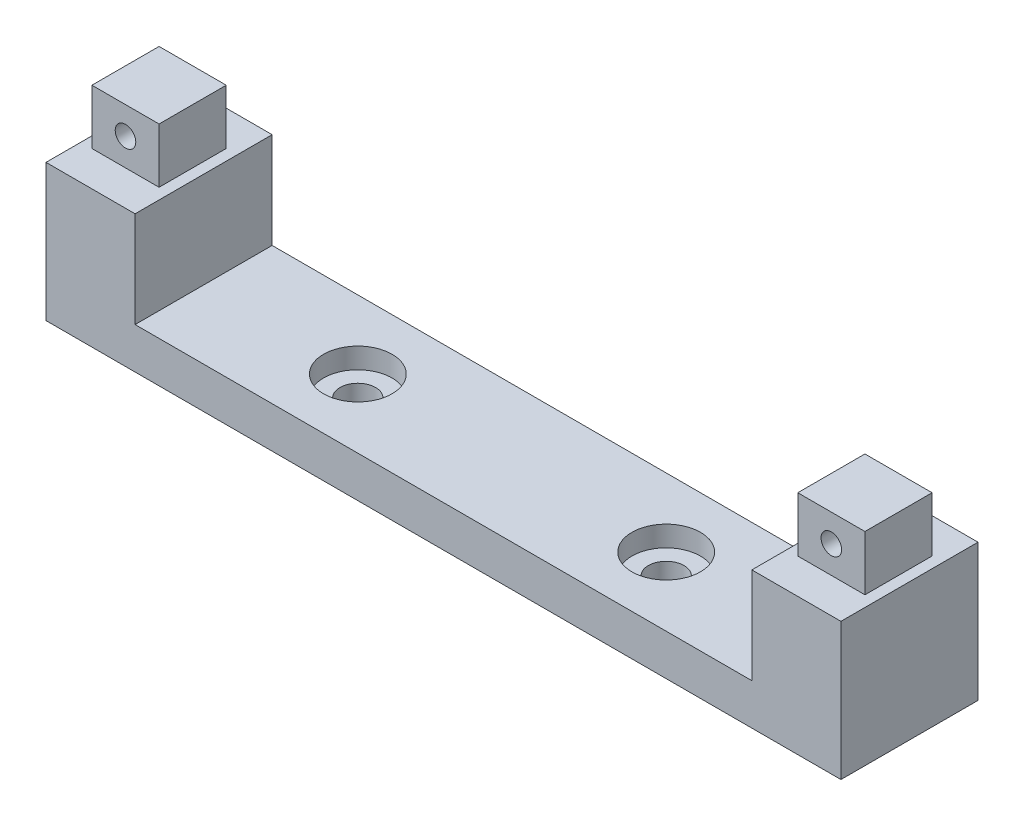
from build123d import *

# Parameters (mm, degrees)
SKETCH_1_W           = 40
SKETCH_1_H           = 20
EXTRUDE_1_DEPTH      = 6
SKETCH_5_W           = 7
SKETCH_5_H           = 20
CUT_EXTRUDE_3_DEPTH  = 6
SKETCH_6_W           = 13
SKETCH_6_H           = 20
EXTRUDE_2_DEPTH      = 20
EXTRUDE_3_DEPTH      = 8
CUT_EXTRUDE_4_DEPTH  = 10
EXTRUDE_4_DEPTH      = 20
EXTRUDE_5_DEPTH      = 8
CUT_EXTRUDE_5_DEPTH  = 10
CUT_EXTRUDE_6_DEPTH  = 3
SKETCH_16_R          = 2.6
CUT_EXTRUDE_7_DEPTH  = 3
CUT_EXTRUDE_8_DEPTH  = 20
SKETCH_19_W          = 90
SKETCH_19_H          = 6
EXTRUDE_6_DEPTH      = 20
CUT_EXTRUDE_9_DEPTH  = 20
SKETCH_21_R          = 5
CUT_EXTRUDE_10_DEPTH = 3


with BuildPart() as part:
    # 草图1 → 凸台-拉伸1 (new body)
    with BuildSketch(Plane(origin=(0, 0, 0), x_dir=(1, 0, 0), z_dir=(0, 1, 0))):
        with Locations((20, -10)):
            Rectangle(SKETCH_1_W, SKETCH_1_H)
    extrude(amount=EXTRUDE_1_DEPTH)

    # 草图5 → 切除-拉伸3 (cut)
    with BuildSketch(Plane(origin=(0, 6, 0), x_dir=(1, 0, 0), z_dir=(0, 1, 0))):
        with Locations((36.5, -10)):
            Rectangle(SKETCH_5_W, SKETCH_5_H)
    extrude(amount=-CUT_EXTRUDE_3_DEPTH, mode=Mode.SUBTRACT)

    # 草图6 → 凸台-拉伸2 (add)
    # profile 1 of 3: a face of its own
    with BuildSketch(Plane(origin=(0, 6, 0), x_dir=(1, 0, 0), z_dir=(0, 1, 0))):
        with Locations((26.5, -10)):
            Rectangle(SKETCH_6_W, SKETCH_6_H)
        Polygon((31.5, -5), (31.5, -10), (31.5, -15), (21.5, -15), (21.5, -10), (21.5, -5), align=None, mode=Mode.SUBTRACT)
    # profile 2 of 3: a face of its own
    with BuildSketch(Plane(origin=(0, 6, 0), x_dir=(1, 0, 0), z_dir=(0, 1, 0))):
        Polygon((21.5, -10), (26.5, -10), (31.5, -10), (31.5, -5), (21.5, -5), align=None)
    # profile 3 of 3: a face of its own
    with BuildSketch(Plane(origin=(0, 6, 0), x_dir=(1, 0, 0), z_dir=(0, 1, 0))):
        Polygon((31.5, -10), (26.5, -10), (21.5, -10), (21.5, -15), (31.5, -15), align=None)
    extrude(amount=EXTRUDE_2_DEPTH)

    # 草图8 → 凸台-拉伸3 (add)
    with BuildSketch(Plane(origin=(0, 26, 0), x_dir=(1, 0, 0), z_dir=(0, 1, 0))):
        Polygon((31.4, -5.1), (23.315, -5.1), (26.5, -10), (31.4, -10), align=None)
        Polygon((26.5, -10), (23.315, -5.1), (21.6, -5.1), (21.6, -10), align=None)
        Polygon((29.685, -14.9), (26.5, -10), (21.6, -10), (21.6, -14.9), align=None)
        Polygon((31.4, -10), (26.5, -10), (29.685, -14.9), (31.4, -14.9), align=None)
    extrude(amount=EXTRUDE_3_DEPTH)

    # 草图9 → 切除-拉伸4 (cut)
    with BuildSketch(Plane.XY.offset(14.9)):
        with BuildLine():
            ThreePointArc((28, 30), (27.560660172, 31.060660172), (26.5, 31.5))
            Line((26.5, 31.5), (26.5, 28.5))
            ThreePointArc((26.5, 28.5), (27.560660172, 28.939339828), (28, 30))
        make_face()
        with BuildLine():
            Line((26.5, 28.5), (26.5, 31.5))
            ThreePointArc((26.5, 31.5), (25, 30), (26.5, 28.5))
        make_face()
    extrude(amount=-CUT_EXTRUDE_4_DEPTH, mode=Mode.SUBTRACT)

    # 草图10 → 凸台-拉伸4 (add)
    with BuildSketch(Plane.XY.offset(20)):
        Polygon((0, 0), (0, 6), (-70, 6), (-70, 26), (-83, 26), (-83, 0), align=None)
    extrude(amount=-EXTRUDE_4_DEPTH)

    # 草图12 → 凸台-拉伸5 (add)
    with BuildSketch(Plane(origin=(0, 26, 0), x_dir=(1, 0, 0), z_dir=(0, 1, 0))):
        Polygon((-71.6, -5.1), (-79.685, -5.1), (-76.5, -10), (-71.6, -10), align=None)
        Polygon((-76.5, -10), (-79.685, -5.1), (-81.4, -5.1), (-81.4, -10), align=None)
        Polygon((-73.315, -14.9), (-76.5, -10), (-81.4, -10), (-81.4, -14.9), align=None)
        Polygon((-71.6, -10), (-76.5, -10), (-73.315, -14.9), (-71.6, -14.9), align=None)
    extrude(amount=EXTRUDE_5_DEPTH)

    # 草图13 → 切除-拉伸5 (cut)
    with BuildSketch(Plane.XY.offset(14.9)):
        with BuildLine():
            ThreePointArc((-75, 30), (-75.996506058, 31.412973407), (-77.6619918, 30.948564735))
            Line((-77.6619918, 30.948564735), (-75.3380082, 29.051435265))
            ThreePointArc((-75.3380082, 29.051435265), (-75.087026593, 29.496506058), (-75, 30))
        make_face()
        with BuildLine():
            Line((-75.3380082, 29.051435265), (-77.6619918, 30.948564735))
            ThreePointArc((-77.6619918, 30.948564735), (-77.448564735, 28.8380082), (-75.3380082, 29.051435265))
        make_face()
    extrude(amount=-CUT_EXTRUDE_5_DEPTH, mode=Mode.SUBTRACT)

    # 草图15 → 切除-拉伸6 (cut)
    with BuildSketch(Plane(origin=(0, 6, 0), x_dir=(1, 0, 0), z_dir=(0, 1, 0))):
        with BuildLine():
            ThreePointArc((-52.5, -10), (-47.5, -15), (-42.5, -10))
            Line((-42.5, -10), (-52.5, -10))
        make_face()
        with BuildLine():
            Line((-52.5, -10), (-42.5, -10))
            ThreePointArc((-42.5, -10), (-47.5, -5), (-52.5, -10))
        make_face()
        with BuildLine():
            ThreePointArc((2.5, -10), (-2.5, -5), (-7.5, -10))
            Line((-7.5, -10), (2.5, -10))
        make_face()
        with BuildLine():
            Line((2.5, -10), (-7.5, -10))
            ThreePointArc((-7.5, -10), (-2.5, -15), (2.5, -10))
        make_face()
    extrude(amount=-CUT_EXTRUDE_6_DEPTH, mode=Mode.SUBTRACT)

    # 草图16 → 切除-拉伸7 (cut)
    with BuildSketch(Plane(origin=(0, 3, 0), x_dir=(1, 0, 0), z_dir=(0, 1, 0))):
        with Locations(Location((-47.5, -10, 0), (0, 0, 270))):
            Circle(SKETCH_16_R)
        with Locations(Location((-2.5, -10, 0), (0, 0, 270))):
            Circle(SKETCH_16_R)
    extrude(amount=-CUT_EXTRUDE_7_DEPTH, mode=Mode.SUBTRACT)

    # 草图18 → 切除-拉伸8 (cut)
    with BuildSketch(Plane(origin=(0, 0, 0), x_dir=(-1, 0, 0), z_dir=(0, 0, -1))):
        Polygon((-20, 6), (-33, 6), (-33, 0), (83, 0), (83, 6), (70, 6), align=None)
    extrude(amount=-CUT_EXTRUDE_8_DEPTH, mode=Mode.SUBTRACT)


with BuildPart() as cut_extrude_8_piece_1:
    # of the separate pieces the step leaves, piece 1, a body of its own (cut_extrude_8_pieces)
    add(part.part.solids().sort_by_distance((-70, 6, 0))[0])



with BuildPart() as cut_extrude_8_piece_2:
    # of the separate pieces the step leaves, piece 2, a body of its own (cut_extrude_8_pieces)
    add(part.part.solids().sort_by_distance((33, 26, 0))[0])


with BuildPart() as cut_extrude_8_piece_1_1:
    add(cut_extrude_8_piece_1.part)

    add(cut_extrude_8_piece_2.part)  # 凸台-拉伸6 merges 切除-拉伸8 piece 2
    # 草图19 → 凸台-拉伸6 (add)
    with BuildSketch(Plane(origin=(0, 0, 0), x_dir=(-1, 0, 0), z_dir=(0, 0, -1))):
        with Locations((25, 9)):
            Rectangle(SKETCH_19_W, SKETCH_19_H)
    extrude(amount=-EXTRUDE_6_DEPTH)

    # 草图20 → 切除-拉伸9 (cut)
    with BuildSketch(Plane(origin=(0, 12, 0), x_dir=(1, 0, 0), z_dir=(0, 1, 0))):
        with BuildLine():
            ThreePointArc((-50.1, -10), (-47.5, -12.6), (-44.9, -10))
            Line((-44.9, -10), (-50.1, -10))
        make_face()
        with BuildLine():
            Line((-50.1, -10), (-44.9, -10))
            ThreePointArc((-44.9, -10), (-47.5, -7.4), (-50.1, -10))
        make_face()
        with BuildLine():
            ThreePointArc((0.1, -10), (-2.5, -7.4), (-5.1, -10))
            Line((-5.1, -10), (0.1, -10))
        make_face()
        with BuildLine():
            Line((0.1, -10), (-5.1, -10))
            ThreePointArc((-5.1, -10), (-2.5, -12.6), (0.1, -10))
        make_face()
    extrude(amount=-CUT_EXTRUDE_9_DEPTH, mode=Mode.SUBTRACT)

    # 草图21 → 切除-拉伸10 (cut)
    with BuildSketch(Plane(origin=(0, 12, 0), x_dir=(1, 0, 0), z_dir=(0, 1, 0))):
        with Locations(Location((-47.5, -10, 0), (0, 0, 270))):
            Circle(SKETCH_21_R)
        with Locations(Location((-2.5, -10, 0), (0, 0, 270))):
            Circle(SKETCH_21_R)
    extrude(amount=-CUT_EXTRUDE_10_DEPTH, mode=Mode.SUBTRACT)


solid = cut_extrude_8_piece_1_1.part
